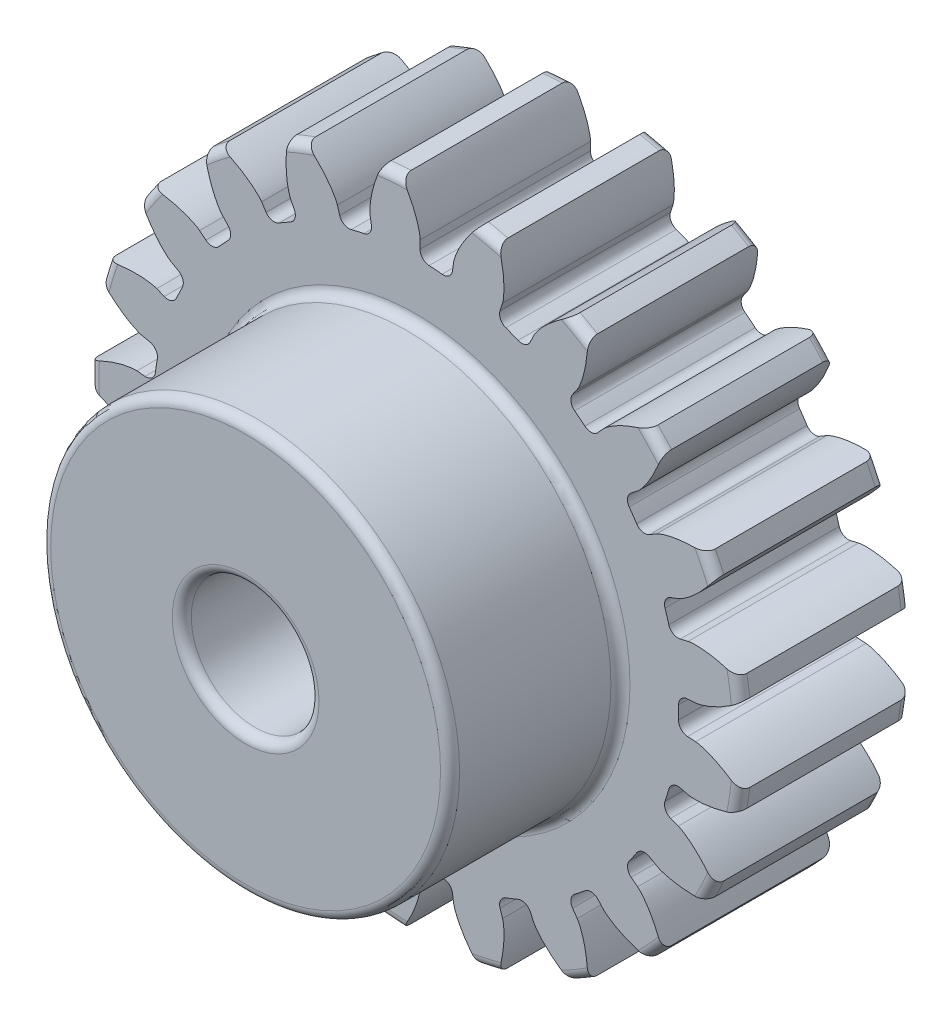
from build123d import *

# Parameters (mm, degrees)
BOSS_EXTRUDE1_DEPTH      = 6.35
BOSS_EXTRUDE1_DEPTH_BACK = 6.35
SKETCH3_R                = 12.170833333
SKETCH5_W                = 6.35
SKETCH5_H                = 4.550833333
SKETCH5_W_2              = 12.7
SKETCH5_H_2              = 2.38125
FILLET2_R                = 0.355076163
CUT_EXTRUDE1_DEPTH       = 19.346140413
FILLET1_R                = 0.355076163
CIRPATTERN1_COUNT        = 21
FILLET1_OF_CIRPATTERN1_R = 0.355076163


with BuildPart() as part:
    # Sketch3 → Boss-Extrude1 (new, two sides: drawn at the far end of the back side and taken through both)
    with BuildSketch(Plane.XY.offset(-BOSS_EXTRUDE1_DEPTH_BACK)):
        Circle(SKETCH3_R)
    extrude(amount=BOSS_EXTRUDE1_DEPTH + BOSS_EXTRUDE1_DEPTH_BACK)

    # Sketch5 → Cut-Revolve1 (revolve, cut)
    with BuildSketch(Plane(origin=(0, 0, 0), x_dir=(0, 0, -1), z_dir=(1, 0, 0)), mode=Mode.PRIVATE) as cut_revolve1_sk:
        with Locations((-3.175, 9.895416667)):
            Rectangle(SKETCH5_W, SKETCH5_H)
        with Locations((0, 1.190625)):
            Rectangle(SKETCH5_W_2, SKETCH5_H_2)
    revolve(cut_revolve1_sk.sketch.rotate(Axis((0, 0, 6.35), (0, 0, -1)), 90), axis=Axis((0, 0, 6.35), (0, 0, -1)), mode=Mode.SUBTRACT)

    # Fillet2
    fillet2_edges = [part.edges().sort_by_distance(p)[0] for p in [
        (-2.38125, 0, 6.35),
        (-2.38125, 0, -6.35),
        (-7.62, 0, 6.35),
        (-7.62, 0, 0),
        (-12.170833333, 0, 0),
        (-12.170833333, 0, -6.35),
    ]]
    fillet(fillet2_edges, radius=FILLET2_R)

    # Sketch4 → Cut-Extrude1 (cut, symmetric)
    with BuildSketch(Plane.XY):
        with BuildLine():
            Line((9.772028694, 0.58600089), (10.423609099, 0.625074322))
            add(Edge.make_bspline(
                [(10.423609099, 0.625074322), (10.426369335, 0.625274961), (10.434103454, 0.625946), (10.44869334, 0.627642203), (10.472445361, 0.631016463), (10.502620524, 0.636206444), (10.541505811, 0.643935599), (10.587149062, 0.654351864), (10.637119835, 0.66717004), (10.691262232, 0.682591947), (10.745064698, 0.699280313), (10.798523746, 0.71713746), (10.851577456, 0.736015226), (10.915591323, 0.760165836), (10.991991234, 0.790906943), (11.080729115, 0.829424447), (11.180678298, 0.876152877), (11.281749872, 0.927014403), (11.380534576, 0.979717052), (11.479522673, 1.035999422), (11.574713949, 1.092603887), (11.672688197, 1.154481139), (11.762669349, 1.213166933), (11.862428599, 1.282302341), (11.94263246, 1.339086197), (12.024568708, 1.400549426), (12.064311026, 1.430877048), (12.084563588, 1.446550006)],
                knots=[0, 0, 0, 0, 0, 0.005376749, 0.015083688, 0.02853182, 0.04661014, 0.064854849, 0.092110526, 0.119476176, 0.146842496, 0.174208854, 0.201574956, 0.228941013, 0.256307345, 0.307035032, 0.361767352, 0.416499661, 0.471231937, 0.525964282, 0.580696616, 0.635428982, 0.690161387, 0.744893688, 0.799626082, 0.854358407, 0.909090915, 0.909090915, 0.909090915, 0.909090915, 0.909090915], degree=4))
            ThreePointArc((12.084563588, 1.446550006), (12.170833333, 0), (12.084563588, -1.446550006))
            add(Edge.make_bspline(
                [(10.423609099, -0.625074322), (10.426369335, -0.625274961), (10.434103454, -0.625946), (10.44869334, -0.627642203), (10.472445361, -0.631016463), (10.502620524, -0.636206444), (10.541505811, -0.643935599), (10.587149062, -0.654351864), (10.637119835, -0.66717004), (10.691262232, -0.682591947), (10.745064698, -0.699280313), (10.798523746, -0.71713746), (10.851577456, -0.736015226), (10.915591323, -0.760165836), (10.991991234, -0.790906943), (11.080729115, -0.829424447), (11.180678298, -0.876152877), (11.281749872, -0.927014403), (11.380534576, -0.979717052), (11.479522673, -1.035999422), (11.574713949, -1.092603887), (11.672688197, -1.154481139), (11.762669349, -1.213166933), (11.862428599, -1.282302341), (11.94263246, -1.339086197), (12.024568708, -1.400549426), (12.064311026, -1.430877048), (12.084563588, -1.446550006)],
                knots=[0, 0, 0, 0, 0, 0.005376749, 0.015083688, 0.02853182, 0.04661014, 0.064854849, 0.092110526, 0.119476176, 0.146842496, 0.174208854, 0.201574956, 0.228941013, 0.256307345, 0.307035032, 0.361767352, 0.416499661, 0.471231937, 0.525964282, 0.580696616, 0.635428982, 0.690161387, 0.744893688, 0.799626082, 0.854358407, 0.909090915, 0.909090915, 0.909090915, 0.909090915, 0.909090915], degree=4))
            Line((10.423609099, -0.625074322), (9.772028694, -0.58600089))
            ThreePointArc((9.772028694, -0.58600089), (9.789583333, 0), (9.772028694, 0.58600089))
        make_face()
    cut_extrude1 = extrude(amount=CUT_EXTRUDE1_DEPTH, both=True, mode=Mode.SUBTRACT)

    # Fillet1
    fillet1_edges = [part.edges().sort_by_distance(p)[0] for p in [
        (9.772028694, -0.58600089, -3.175),
        (9.772028694, 0.58600089, -3.175),
    ]]
    fillet(fillet1_edges, radius=FILLET1_R)

    # CirPattern1: Cut-Extrude1 ×21 about axis
    cirpattern1_axis = Axis((0, 0, 6.35), (0, 0, -1))
    for i in range(1, CIRPATTERN1_COUNT):
        add(cut_extrude1.rotate(cirpattern1_axis, i * 360 / CIRPATTERN1_COUNT), mode=Mode.SUBTRACT)

    # Fillet1 of CirPattern1
    fillet1_of_cirpattern1_edges = [part.edges().sort_by_distance(p)[0] for p in [
        (9.165158083, -3.440322537, -3.175),
        (9.510611672, -2.320389507, -3.175),
        (7.743922955, -5.988956429, -3.175),
        (8.404135066, -5.020603114, -3.175),
        (5.634606289, -8.00544526, -3.175),
        (6.550914179, -7.274714102, -3.175),
        (3.024630128, -9.310615148, -3.175),
        (4.115615819, -8.882434817, -3.175),
        (0.145902306, -9.788496021, -3.175),
        (1.314626932, -9.700912218, -3.175),
        (-2.745789576, -9.396626067, -3.175),
        (-1.603172327, -9.657420998, -3.175),
        (-5.393506005, -8.16982465, -3.175),
        (-4.378522689, -8.755825541, -3.175),
        (-7.561985756, -6.217098461, -3.175),
        (-6.764822096, -7.07623656, -3.175),
        (-9.058549887, -3.71195579, -3.175),
        (-8.550037372, -4.767892907, -3.175),
        (-9.750222108, -0.876989557, -3.175),
        (-9.575544307, -2.035901046, -3.175),
        (-9.575544307, 2.035901046, -3.175),
        (-9.750222108, 0.876989557, -3.175),
        (-8.550037372, 4.767892907, -3.175),
        (-9.058549887, 3.71195579, -3.175),
        (-6.764822096, 7.07623656, -3.175),
        (-7.561985756, 6.217098461, -3.175),
        (-4.378522689, 8.755825541, -3.175),
        (-5.393506005, 8.16982465, -3.175),
        (-1.603172327, 9.657420998, -3.175),
        (-2.745789576, 9.396626067, -3.175),
        (1.314626932, 9.700912218, -3.175),
        (0.145902306, 9.788496021, -3.175),
        (4.115615819, 8.882434817, -3.175),
        (3.024630128, 9.310615148, -3.175),
        (6.550914179, 7.274714102, -3.175),
        (5.634606289, 8.00544526, -3.175),
        (8.404135066, 5.020603114, -3.175),
        (7.743922955, 5.988956429, -3.175),
        (9.510611672, 2.320389507, -3.175),
        (9.165158083, 3.440322537, -3.175),
    ]]
    fillet(fillet1_of_cirpattern1_edges, radius=FILLET1_OF_CIRPATTERN1_R)


solid = part.part
